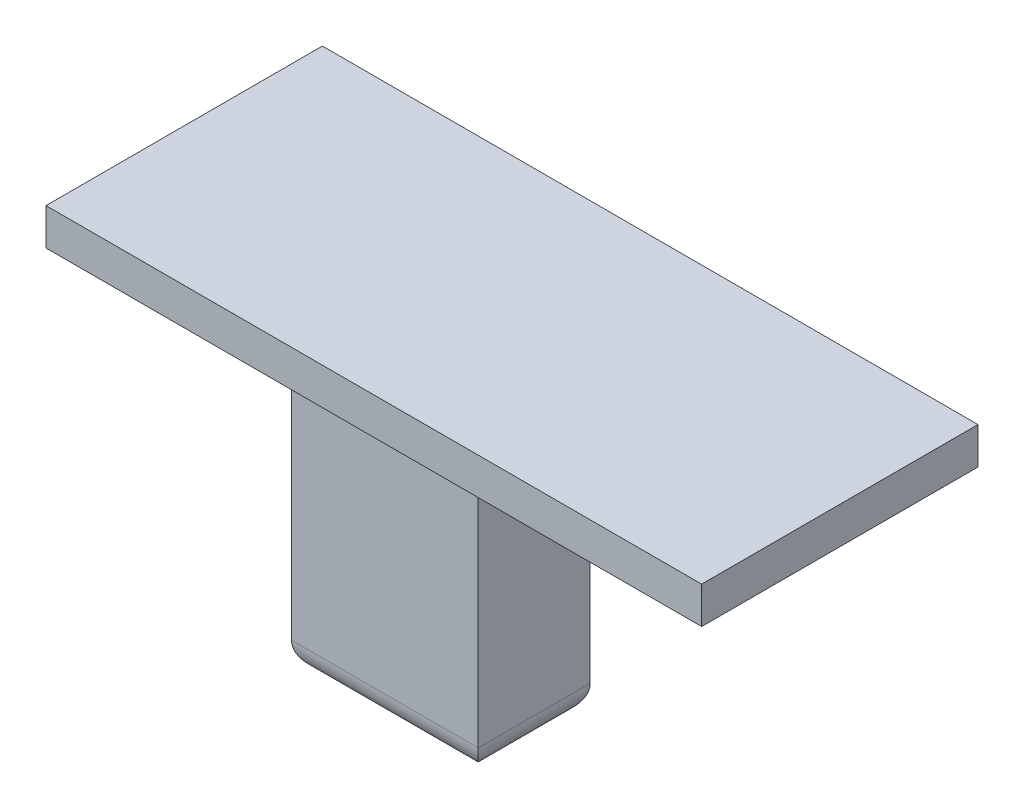
from build123d import *

# Parameters (mm, degrees)
SKETCH1_W           = 44.6
SKETCH1_H           = 18.8
BOSS_EXTRUDE1_DEPTH = 2.5
SKETCH2_W           = 12.7
SKETCH2_H           = 7.62
BOSS_EXTRUDE2_DEPTH = 20
FILLET1_R           = 2
FILLET2_R           = 0.5


with BuildPart() as part:
    # Sketch1 → Boss-Extrude1 (new body)
    with BuildSketch(Plane(origin=(0, 0, 0), x_dir=(1, 0, 0), z_dir=(0, 1, 0))):
        with Locations((0, 6.65)):
            Rectangle(SKETCH1_W, SKETCH1_H)
    extrude(amount=-BOSS_EXTRUDE1_DEPTH)

    # Sketch2 → Boss-Extrude2 (add)
    with BuildSketch(Plane(origin=(0, 0, 0), x_dir=(1, 0, 0), z_dir=(0, 1, 0))):
        with Locations((0, 1.81)):
            Rectangle(SKETCH2_W, SKETCH2_H)
    extrude(amount=-BOSS_EXTRUDE2_DEPTH)

    # Fillet1
    fillet1_edges = [part.edges().sort_by_distance(p)[0] for p in [
        (6.35, -20, -1.81),
        (0, -20, 2),
        (-6.35, -20, -1.81),
        (0, -20, -5.62),
    ]]
    fillet(fillet1_edges, radius=FILLET1_R)

    # Fillet2
    fillet2_edges = [part.edges().sort_by_distance(p)[0] for p in [
        (6.35, -2.5, -1.81),
        (0, -2.5, 2),
        (-6.35, -2.5, -1.81),
        (0, -2.5, -5.62),
    ]]
    fillet(fillet2_edges, radius=FILLET2_R)


solid = part.part
